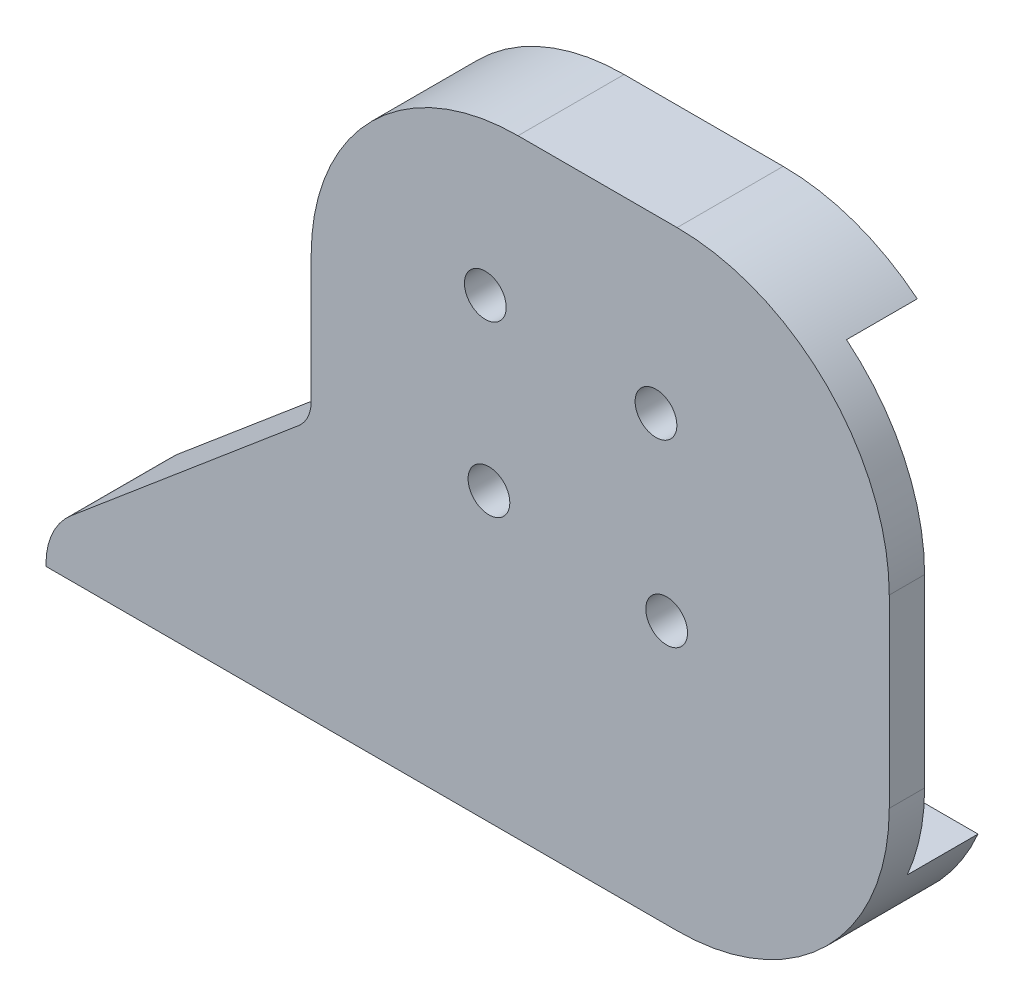
from build123d import *

# Parameters (mm, degrees)
BOSS_EXTRUDE1_DEPTH = 7.62
SKETCH4_3_R         = 1.5
BOSS_EXTRUDE2_DEPTH = 2.54
SKETCH5_W           = 60.579
SKETCH5_H           = 7.62
BOSS_EXTRUDE3_DEPTH = 2.54
FILLET1_R           = 15.24
FILLET2_R           = 5.08
FILLET3_R           = 2.54


with BuildPart() as part:
    # Sketch4 → Boss-Extrude1 (new body)
    with BuildSketch(Plane.XY):
        with BuildLine():
            Line((34.731702618, -14.493095403), (-3.368297382, -14.493095403))
            Line((-3.368297382, -14.493095403), (-3.368297382, -11.064095403))
            Line((-3.368297382, -11.064095403), (-3.368297382, -8.326281589))
            Line((-3.368297382, -8.326281589), (-3.368297382, 5.191904597))
            ThreePointArc((-3.368297382, 5.191904597), (-0.020527891, 13.274135106), (8.061702618, 16.621904597))
            Line((8.061702618, 16.621904597), (34.731702618, 16.621904597))
            Line((34.731702618, 16.621904597), (34.731702618, 20.050904597))
            Line((34.731702618, 20.050904597), (8.061702618, 20.050904597))
            ThreePointArc((8.061702618, 20.050904597), (-2.445197043, 15.698804259), (-6.797297382, 5.191904597))
            Line((-6.797297382, 5.191904597), (-6.797297382, -5.10519069))
            Line((-6.797297382, -5.10519069), (-6.797297382, -14.493095403))
            Line((-6.797297382, -14.493095403), (-6.797297382, -17.922095403))
            Line((-6.797297382, -17.922095403), (-3.368297382, -17.922095403))
            Line((-3.368297382, -17.922095403), (34.731702618, -17.922095403))
            Line((34.731702618, -17.922095403), (34.731702618, -14.493095403))
        make_face()
        Polygon((-6.797297382, -21.160595403), (-6.797297382, -17.922095403), (-6.797297382, -14.493095403), (-6.797297382, -5.10519069), (-25.847297382, -21.160595403), align=None)
        Polygon((-6.797297382, -21.160595403), (34.731702618, -21.160595403), (34.731702618, -17.922095403), (-3.368297382, -17.922095403), (-6.797297382, -17.922095403), align=None)
    extrude(amount=-BOSS_EXTRUDE1_DEPTH)

    # Sketch4<3> → Boss-Extrude2 (add)
    with BuildSketch(Plane.XY):
        with BuildLine():
            Line((-3.368297382, -11.064095403), (-3.368297382, -14.493095403))
            Line((-3.368297382, -14.493095403), (34.731702618, -14.493095403))
            Line((34.731702618, -14.493095403), (34.731702618, 16.621904597))
            Line((34.731702618, 16.621904597), (8.061702618, 16.621904597))
            ThreePointArc((8.061702618, 16.621904597), (-0.020527891, 13.274135106), (-3.368297382, 5.191904597))
            Line((-3.368297382, 5.191904597), (-3.368297382, -8.326281589))
            Line((-3.368297382, -8.326281589), (-3.368297382, -11.064095403))
        make_face()
        with Locations((5.973177543, -3.081984913)):
            Circle(SKETCH4_3_R, mode=Mode.SUBTRACT)
        with Locations((18.742087817, -4.794749031)):
            Circle(SKETCH4_3_R, mode=Mode.SUBTRACT)
        with Locations((5.712659725, 8.949609908)):
            Circle(SKETCH4_3_R, mode=Mode.SUBTRACT)
        with Locations((17.97317096, 7.733253911)):
            Circle(SKETCH4_3_R, mode=Mode.SUBTRACT)
    extrude(amount=-BOSS_EXTRUDE2_DEPTH)

    # Sketch5 → Boss-Extrude3 (add)
    with BuildSketch(Plane.XZ.offset(21.160595403)):
        with Locations((4.442202618, -3.81)):
            Rectangle(SKETCH5_W, SKETCH5_H)
    extrude(amount=BOSS_EXTRUDE3_DEPTH)

    # Fillet1
    fillet1_edges = [part.edges().sort_by_distance(p)[0] for p in [
        (34.731702618, 20.050904597, -3.81),
        (34.731702618, -23.700595403, -3.81),
    ]]
    fillet(fillet1_edges, radius=FILLET1_R)

    # Fillet2
    fillet2_edges = [part.edges().sort_by_distance(p)[0] for p in [
        (-25.847297382, -21.160595403, -3.81),
    ]]
    fillet(fillet2_edges, radius=FILLET2_R)

    # Fillet3
    fillet3_edges = [part.edges().sort_by_distance(p)[0] for p in [
        (-6.797297382, -5.10519069, -3.81),
    ]]
    fillet(fillet3_edges, radius=FILLET3_R)


solid = part.part
